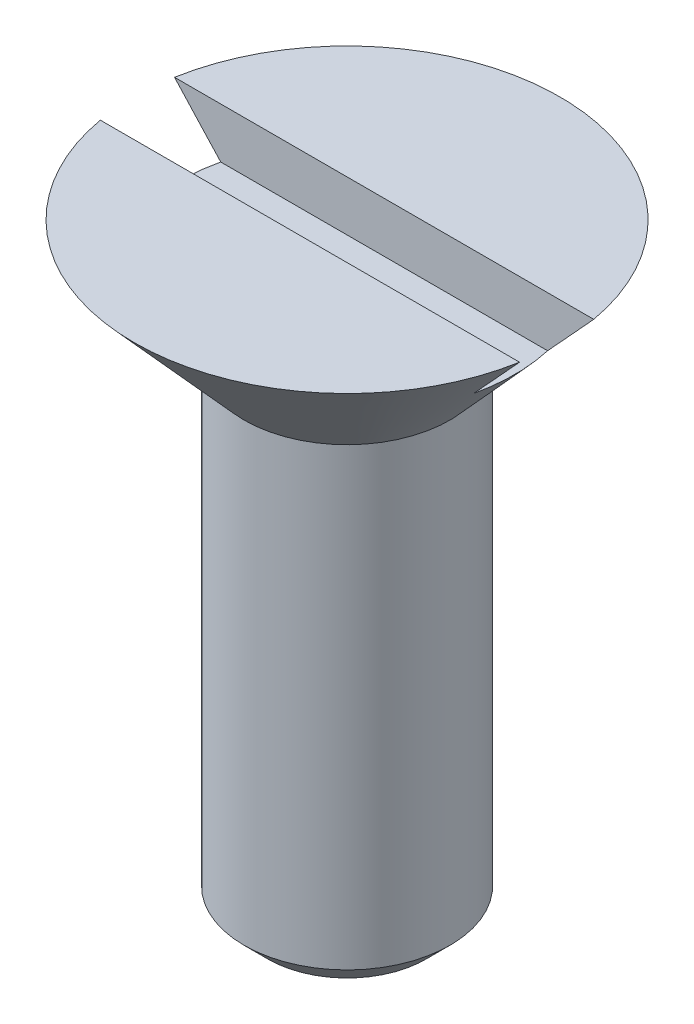
from build123d import *

# Parameters (mm, degrees)
SKETCH1_R     = 1.0922
SHAFT_DEPTH   = 5.08
SKETCH4_W     = 4.517166798
SKETCH4_H     = 0.7874
SLOT_DEPTH    = 0.5334
CHAMFER1_SIZE = 0.254


with BuildPart() as part:
    # Sketch1 → Shaft (new body)
    with BuildSketch(Plane(origin=(0, 0, 0), x_dir=(1, 0, 0), z_dir=(0, 1, 0))):
        with Locations(Location((0, 0, 0), (0, 0, 270))):
            Circle(SKETCH1_R)
    extrude(amount=-SHAFT_DEPTH)

    # Sketch3 → Head (revolve)
    with BuildSketch(Plane.XY, mode=Mode.PRIVATE) as head_sk:
        Polygon((0, 0), (0, 1.2954), (2.258583399, 1.2954), (1.0922, 0), align=None)
    revolve(head_sk.sketch.rotate(Axis((0, 0, 0), (0, 1, 0)), 270), axis=Axis((0, 0, 0), (0, 1, 0)))

    # Sketch4 → Slot (cut)
    with BuildSketch(Plane(origin=(0, 1.2954, 0), x_dir=(1, 0, 0), z_dir=(0, 1, 0))):
        Rectangle(SKETCH4_W, SKETCH4_H)
    extrude(amount=-SLOT_DEPTH, mode=Mode.SUBTRACT)

    # Chamfer1
    chamfer1_edges = [part.edges().sort_by_distance(p)[0] for p in [
        (0, -5.08, -1.0922),
    ]]
    chamfer(chamfer1_edges, length=CHAMFER1_SIZE)


solid = part.part
